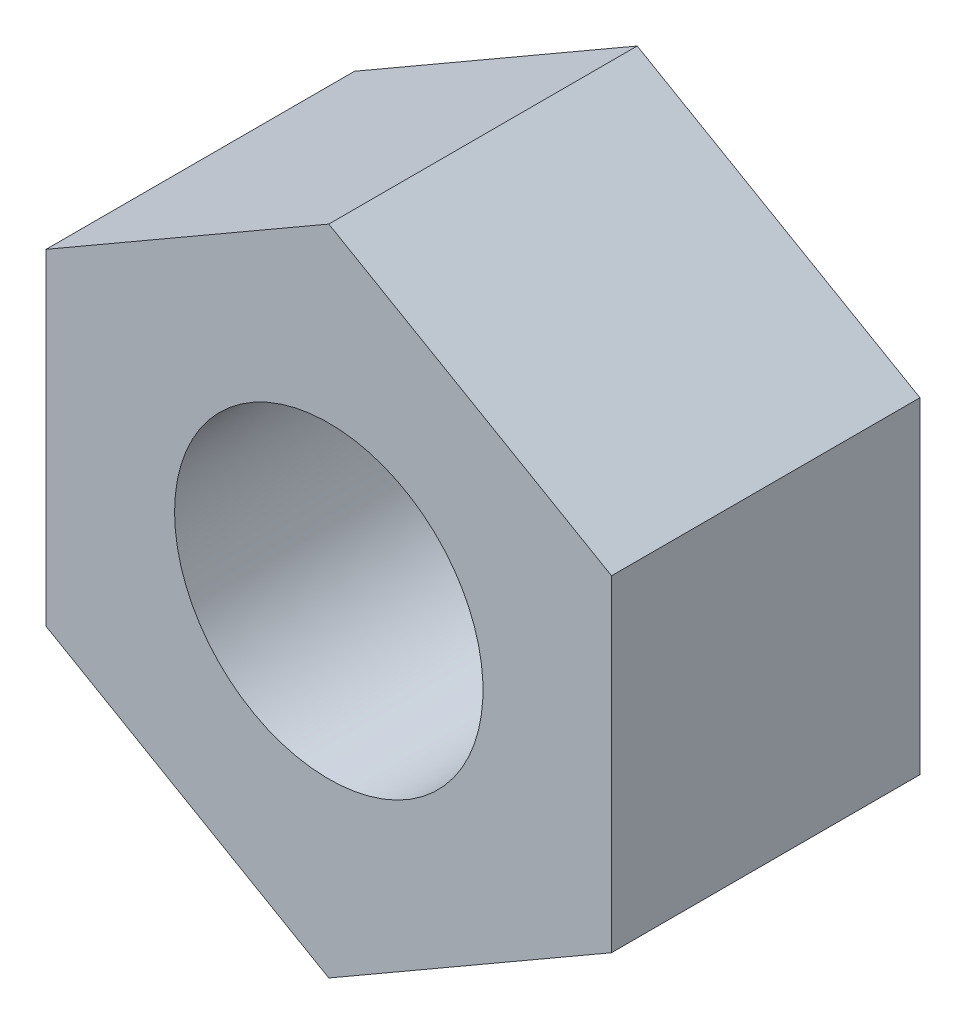
from build123d import *

# Parameters (mm, degrees)
BOSS_EXTRUDE2_DEPTH     = 1.5
CUT_EXTRUDE4_DEPTH      = 5.460474564
CUT_EXTRUDE4_DEPTH_BACK = 5.460474564
SKETCH16_R              = 1.5
SKETCH13_R              = 1.5
BOSS_EXTRUDE1_DEPTH     = 3
SKETCH17_R              = 1.5
BOSS_EXTRUDE3_DEPTH     = 3


with BuildPart() as part:
    # Sketch15 → Boss-Extrude2 (new, symmetric)
    with BuildSketch(Plane.XY):
        Polygon((0, 3.175426481), (-2.75, 1.58771324), (-2.75, -1.58771324), (0, -3.175426481), (2.75, -1.58771324), (2.75, 1.58771324), align=None)
    extrude(amount=BOSS_EXTRUDE2_DEPTH, both=True)

    # Sketch16 → Cut-Extrude4 (cut, two sides: drawn at the far end of the back side and taken through both)
    with BuildSketch(Plane.XY.offset(-CUT_EXTRUDE4_DEPTH_BACK)):
        Circle(SKETCH16_R)
    extrude(amount=CUT_EXTRUDE4_DEPTH + CUT_EXTRUDE4_DEPTH_BACK, mode=Mode.SUBTRACT)

    # Sketch17 → Boss-Extrude3 (add)
    with BuildSketch(Plane.XY.offset(1.5)):
        with Locations(Location((0, 0, 0), (0, 0, 180))):
            Circle(SKETCH17_R)
    extrude(amount=-BOSS_EXTRUDE3_DEPTH)


with BuildPart() as body_2:
    # Sketch13 → Boss-Extrude1 (new body)
    with BuildSketch(Plane(origin=(0, 0, -1.5), x_dir=(-1, 0, 0), z_dir=(0, 0, -1))):
        Circle(SKETCH13_R)
    extrude(amount=-BOSS_EXTRUDE1_DEPTH)


with BuildPart() as part_1:
    add(part.part)

    # Combine1: cut body 2
    add(body_2.part, mode=Mode.SUBTRACT)


solid = part_1.part
